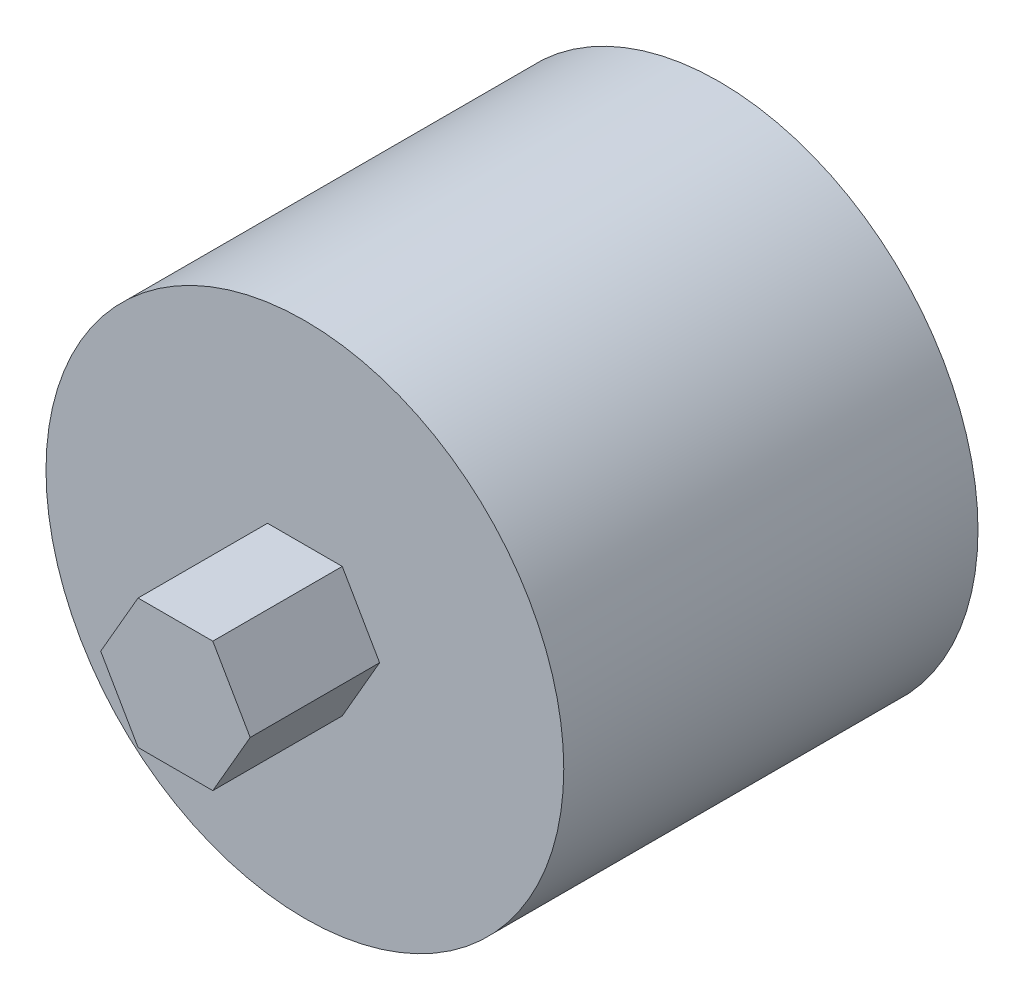
from build123d import *

# Parameters (mm, degrees)
SKETCH_1_R               = 3
SKETCH_1_R_2             = 1.65
EXTRUDE_1_DEPTH          = 4
CUT_EXTRUDE_2_DEPTH      = 6.830951895
PATTERN_CIRCULAR_1_COUNT = 9
SKETCH_2_R               = 3
EXTRUDE_2_DEPTH          = 0.8
EXTRUDE_START            = 0.8
EXTRUDE_3_DEPTH          = 1.5


with BuildPart() as part:
    # 草图1 → 凸台-拉伸1 (new body)
    with BuildSketch(Plane.XY):
        Circle(SKETCH_1_R)
        Circle(SKETCH_1_R_2, mode=Mode.SUBTRACT)
    extrude(amount=EXTRUDE_1_DEPTH)

    # 草图1<3> → 切除-拉伸2 (cut, through all)
    with BuildSketch(Plane.XY):
        with BuildLine():
            Line((1.583201231, 0.595370355), (1.54440693, 0.580781573))
            ThreePointArc((1.54440693, 0.580781573), (1.623387112, 0.295151288), (1.65, 0))
            ThreePointArc((1.65, 0), (1.623387112, -0.295151288), (1.54440693, -0.580781573))
            Line((1.54440693, -0.580781573), (1.583201231, -0.595370355))
            add(Edge.make_bspline(
                [(1.583201231, -0.595370355), (1.595268082, -0.599908151), (1.629927649, -0.609960022), (1.698544644, -0.618780808), (1.810680065, -0.617601716), (1.954246735, -0.59352555), (2.132298369, -0.536822163), (2.302941373, -0.452472776), (2.42578745, -0.372108406), (2.505673341, -0.310927028), (2.533645284, -0.288342805)],
                knots=[0, 0, 0, 0, 0, 0.005604068, 0.015718248, 0.029959916, 0.048733667, 0.068727063, 0.096888892, 0.112551479, 0.112551479, 0.112551479, 0.112551479, 0.112551479], degree=4))
            ThreePointArc((2.533645284, -0.288342805), (2.545908038, -0.144403125), (2.55, 0))
            ThreePointArc((2.55, 0), (2.545908038, 0.144403125), (2.533645284, 0.288342805))
            add(Edge.make_bspline(
                [(1.583201231, 0.595370355), (1.595268082, 0.599908151), (1.629927649, 0.609960022), (1.698544644, 0.618780808), (1.810680065, 0.617601716), (1.954246735, 0.59352555), (2.132298369, 0.536822163), (2.302941373, 0.452472776), (2.42578745, 0.372108406), (2.505673341, 0.310927028), (2.533645284, 0.288342805)],
                knots=[0, 0, 0, 0, 0, 0.005604068, 0.015718248, 0.029959916, 0.048733667, 0.068727063, 0.096888892, 0.112551479, 0.112551479, 0.112551479, 0.112551479, 0.112551479], degree=4))
        make_face()
    cut_extrude_2 = extrude(amount=CUT_EXTRUDE_2_DEPTH, mode=Mode.SUBTRACT)

    # 阵列(圆周)1: 切除-拉伸2 ×9 about axis
    pattern_circular_1_axis = Axis((0, 0, 4), (0, 0, 1))
    for i in range(1, PATTERN_CIRCULAR_1_COUNT):
        add(cut_extrude_2.rotate(pattern_circular_1_axis, i * 360 / PATTERN_CIRCULAR_1_COUNT), mode=Mode.SUBTRACT)

    # 草图2 → 凸台-拉伸2 (add)
    with BuildSketch(Plane.XY.offset(4)):
        Circle(SKETCH_2_R)
    extrude(amount=EXTRUDE_2_DEPTH)

    # 草图2<3> → 凸台-拉伸3 (add)
    with BuildSketch(Plane.XY.offset(4).offset(EXTRUDE_START)):
        Polygon((0.433012702, 0.75), (-0.433012702, 0.75), (-0.866025404, 0), (-0.433012702, -0.75), (0.433012702, -0.75), (0.866025404, 0), align=None)
    extrude(amount=EXTRUDE_3_DEPTH)


solid = part.part
